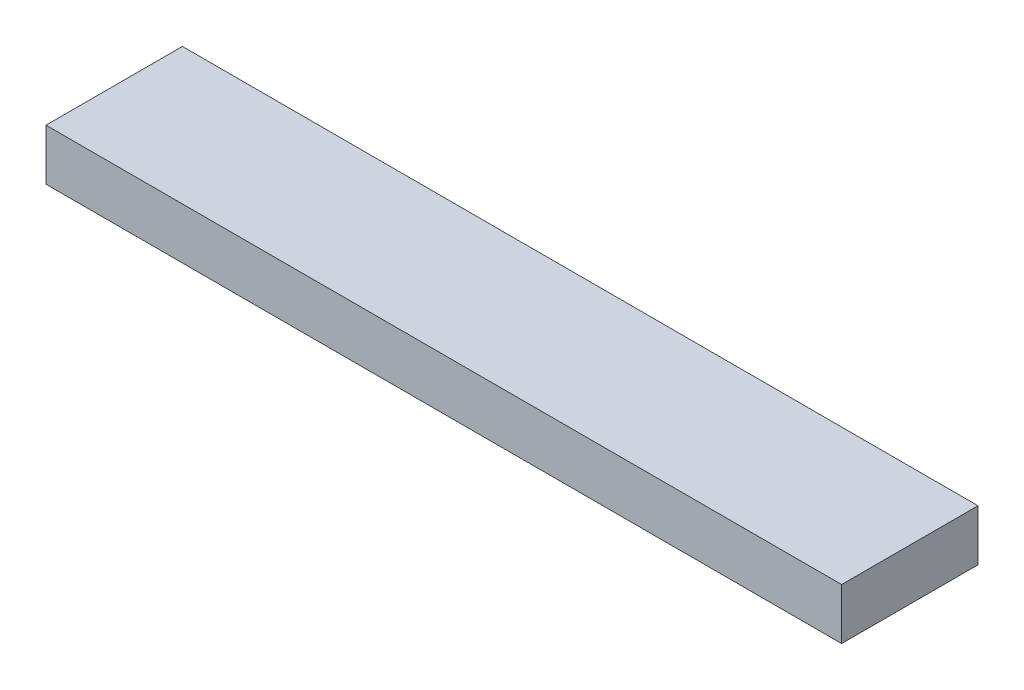
from build123d import *

# Parameters (mm, degrees)
SKETCH_1_W      = 70
SKETCH_1_H      = 12
EXTRUDE_1_DEPTH = 4.5


with BuildPart() as part:
    # 草图1 → 凸台-拉伸1 (new body)
    with BuildSketch(Plane(origin=(0, 0, 0), x_dir=(1, 0, 0), z_dir=(0, 1, 0))):
        with Locations((35, 6)):
            Rectangle(SKETCH_1_W, SKETCH_1_H)
    extrude(amount=EXTRUDE_1_DEPTH)


solid = part.part
